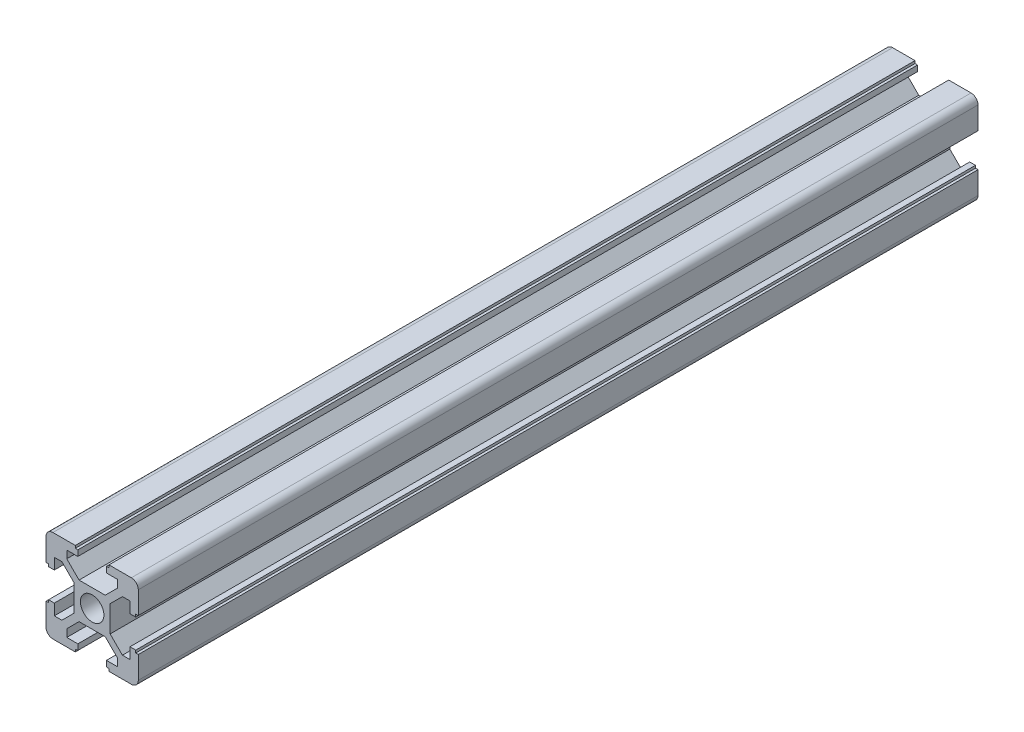
from build123d import *

# Parameters (mm, degrees)
SKETCH_1_R      = 2.55
EXTRUDE_1_DEPTH = 182


with BuildPart() as part:
    # 草图1 → 凸台-拉伸1 (new body)
    with BuildSketch(Plane.XY):
        with BuildLine():
            Line((-3.9, 2.839339828), (-6.560660172, 5.5))
            Line((-6.560660172, 5.5), (-8.2, 5.5))
            Line((-8.2, 5.5), (-8.2, 3.1))
            Line((-8.2, 3.1), (-9.45, 3.1))
            Line((-9.45, 3.1), (-9.45, 3.65))
            Line((-9.45, 3.65), (-10, 3.65))
            Line((-10, 3.65), (-10, 8.5))
            ThreePointArc((-10, 8.5), (-9.560660172, 9.560660172), (-8.5, 10))
            Line((-8.5, 10), (-3.65, 10))
            Line((-3.65, 10), (-3.65, 9.45))
            Line((-3.65, 9.45), (-3.1, 9.45))
            Line((-3.1, 9.45), (-3.1, 8.2))
            Line((-3.1, 8.2), (-5.5, 8.2))
            Line((-5.5, 8.2), (-5.5, 6.560660172))
            Line((-5.5, 6.560660172), (-2.839339828, 3.9))
            Line((-2.839339828, 3.9), (2.839339828, 3.9))
            Line((2.839339828, 3.9), (5.5, 6.560660172))
            Line((5.5, 6.560660172), (5.5, 8.2))
            Line((5.5, 8.2), (3.1, 8.2))
            Line((3.1, 8.2), (3.1, 9.45))
            Line((3.1, 9.45), (3.65, 9.45))
            Line((3.65, 9.45), (3.65, 10))
            Line((3.65, 10), (8.5, 10))
            ThreePointArc((8.5, 10), (9.560660172, 9.560660172), (10, 8.5))
            Line((10, 8.5), (10, 3.65))
            Line((10, 3.65), (9.45, 3.65))
            Line((9.45, 3.65), (9.45, 3.1))
            Line((9.45, 3.1), (8.2, 3.1))
            Line((8.2, 3.1), (8.2, 5.5))
            Line((8.2, 5.5), (6.560660172, 5.5))
            Line((6.560660172, 5.5), (3.9, 2.839339828))
            Line((3.9, 2.839339828), (3.9, -2.839339828))
            Line((3.9, -2.839339828), (6.560660172, -5.5))
            Line((6.560660172, -5.5), (8.2, -5.5))
            Line((8.2, -5.5), (8.2, -3.1))
            Line((8.2, -3.1), (9.45, -3.1))
            Line((9.45, -3.1), (9.45, -3.65))
            Line((9.45, -3.65), (10, -3.65))
            Line((10, -3.65), (10, -8.5))
            ThreePointArc((10, -8.5), (9.560660172, -9.560660172), (8.5, -10))
            Line((8.5, -10), (3.65, -10))
            Line((3.65, -10), (3.65, -9.45))
            Line((3.65, -9.45), (3.1, -9.45))
            Line((3.1, -9.45), (3.1, -8.2))
            Line((3.1, -8.2), (5.5, -8.2))
            Line((5.5, -8.2), (5.5, -6.560660172))
            Line((5.5, -6.560660172), (2.839339828, -3.9))
            Line((2.839339828, -3.9), (-2.839339828, -3.9))
            Line((-2.839339828, -3.9), (-5.5, -6.560660172))
            Line((-5.5, -6.560660172), (-5.5, -8.2))
            Line((-5.5, -8.2), (-3.1, -8.2))
            Line((-3.1, -8.2), (-3.1, -9.45))
            Line((-3.1, -9.45), (-3.65, -9.45))
            Line((-3.65, -9.45), (-3.65, -10))
            Line((-3.65, -10), (-8.5, -10))
            ThreePointArc((-8.5, -10), (-9.560660172, -9.560660172), (-10, -8.5))
            Line((-10, -8.5), (-10, -3.65))
            Line((-10, -3.65), (-9.45, -3.65))
            Line((-9.45, -3.65), (-9.45, -3.1))
            Line((-9.45, -3.1), (-8.2, -3.1))
            Line((-8.2, -3.1), (-8.2, -5.5))
            Line((-8.2, -5.5), (-6.560660172, -5.5))
            Line((-6.560660172, -5.5), (-3.9, -2.839339828))
            Line((-3.9, -2.839339828), (-3.9, 2.839339828))
        make_face()
        Circle(SKETCH_1_R, mode=Mode.SUBTRACT)
    extrude(amount=EXTRUDE_1_DEPTH)


solid = part.part
